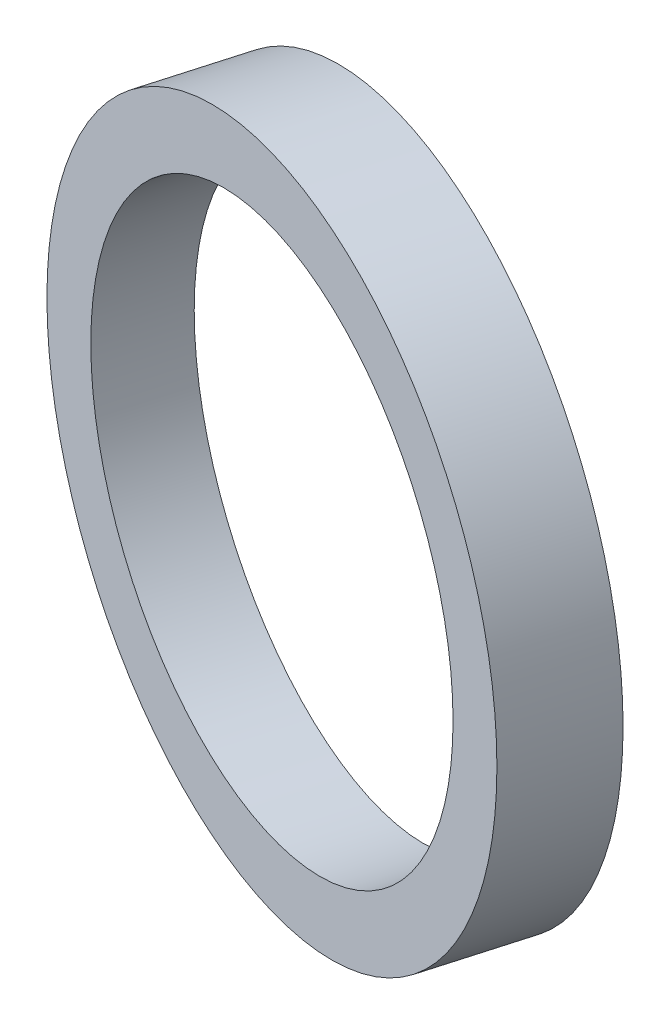
from build123d import *


with BuildPart() as part:
    # Sketch3 → Revolve3 (revolve)
    with BuildSketch(Plane(origin=(0, 0, 0), x_dir=(1, 0, 0), z_dir=(0, 1, 0))):
        Polygon((2.85497171, -0.63434841), (1.569430701, -5.111040394), (-1.242108212, -4.30367), (-0.188414235, -0.63434841), align=None)
    revolve(axis=Axis((-14.848004969, 0, 7.935969835), (0.27600837196521677, 0, -0.9611552312738617)))


solid = part.part
